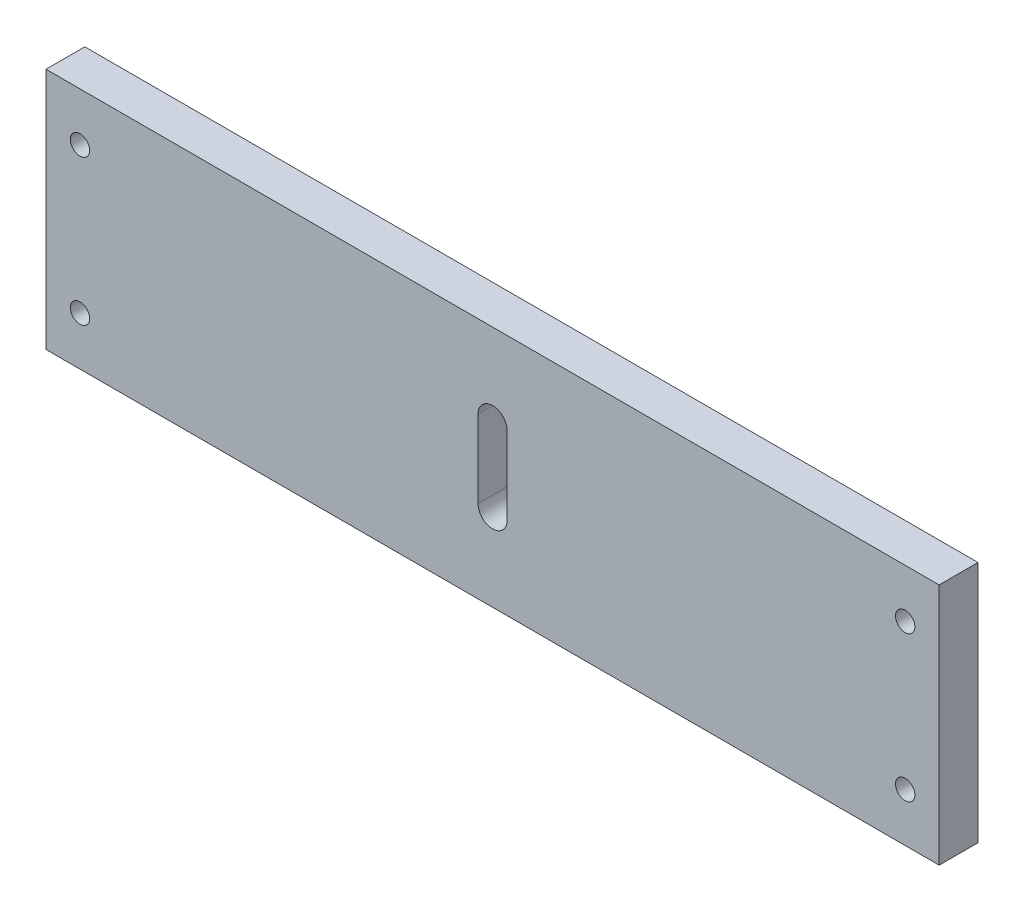
from build123d import *

# Parameters (mm, degrees)
SKETCH_1_W      = 92
SKETCH_1_H      = 25
SKETCH_1_R      = 1
EXTRUDE_1_DEPTH = 4


with BuildPart() as part:
    # 草图1 → 凸台-拉伸1 (new body)
    with BuildSketch(Plane.XY):
        with Locations((3177.83744335, 1618.094307215)):
            Rectangle(SKETCH_1_W, SKETCH_1_H)
        with Locations((3135.33744335, 1625.594307215)):
            Circle(SKETCH_1_R, mode=Mode.SUBTRACT)
        with Locations((3135.33744335, 1610.594307215)):
            Circle(SKETCH_1_R, mode=Mode.SUBTRACT)
        with Locations((3220.33744335, 1610.594307215)):
            Circle(SKETCH_1_R, mode=Mode.SUBTRACT)
        with Locations((3220.33744335, 1625.594307215)):
            Circle(SKETCH_1_R, mode=Mode.SUBTRACT)
        with BuildLine():
            Line((3179.33744335, 1622.094307215), (3179.33744335, 1614.094307215))
            ThreePointArc((3179.33744335, 1614.094307215), (3177.83744335, 1612.594307215), (3176.33744335, 1614.094307215))
            Line((3176.33744335, 1614.094307215), (3176.33744335, 1622.094307215))
            ThreePointArc((3176.33744335, 1622.094307215), (3177.83744335, 1623.594307215), (3179.33744335, 1622.094307215))
        make_face(mode=Mode.SUBTRACT)
    extrude(amount=EXTRUDE_1_DEPTH)


solid = part.part
